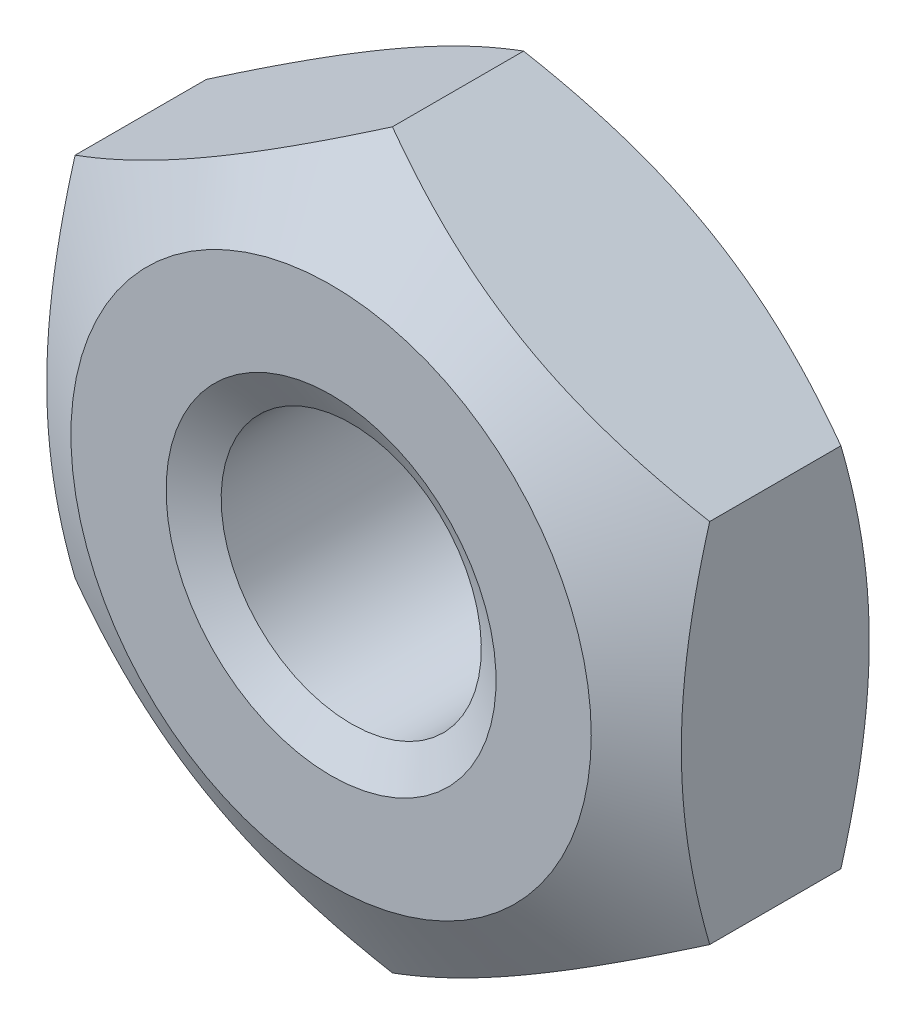
from build123d import *

# Parameters (mm, degrees)
BOSS_EXTRUDE1_DEPTH = 2


with BuildPart() as part:
    # Sketch1 → Boss-Extrude1 (new body)
    with BuildSketch(Plane.XY):
        Polygon((0, 2.886751346), (-2.5, 1.443375673), (-2.5, -1.443375673), (0, -2.886751346), (2.5, -1.443375673), (2.5, 1.443375673), align=None)
    extrude(amount=-BOSS_EXTRUDE1_DEPTH)

    # Sketch4 → Cut-Revolve1 (revolve, cut)
    with BuildSketch(Plane(origin=(0, 0, 0), x_dir=(0, 0, -1), z_dir=(1, 0, 0)), mode=Mode.PRIVATE) as cut_revolve1_sk:
        Polygon((2, 2.886751346), (1.516901385, 2.886751346), (2, 2.05), align=None)
        Polygon((0, 2.886751346), (0.483098615, 2.886751346), (0, 2.05), align=None)
    revolve(cut_revolve1_sk.sketch.rotate(Axis((0, 0, 0), (0, 0, -1)), 299.999999912), axis=Axis((0, 0, 0), (0, 0, -1)), mode=Mode.SUBTRACT)

    # Sketch5 → Cut-Revolve2 (revolve, cut)
    with BuildSketch(Plane(origin=(0, 0, 0), x_dir=(0, 0, -1), z_dir=(1, 0, 0)), mode=Mode.PRIVATE) as cut_revolve2_sk:
        Polygon((0, 0), (0, 1.3), (0.158771324, 1.025), (1.841228676, 1.025), (2, 1.3), (2, 0), align=None)
    revolve(cut_revolve2_sk.sketch.rotate(Axis((0, 0, 0), (0, 0, -1)), 180), axis=Axis((0, 0, 0), (0, 0, -1)), mode=Mode.SUBTRACT)


solid = part.part
